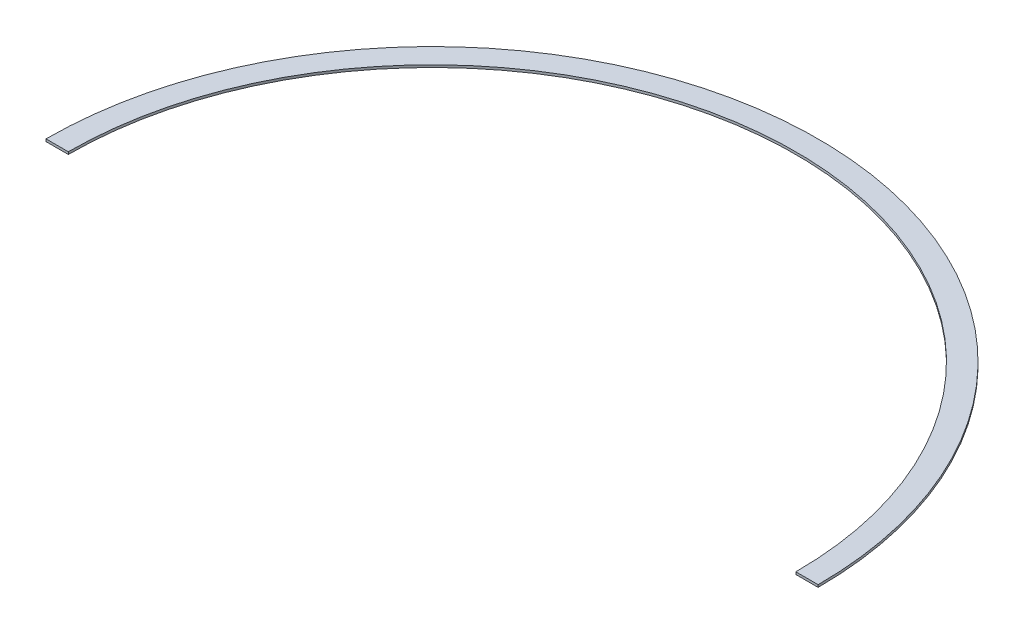
from build123d import *

# Parameters (mm, degrees)
BOSS_EXTRUDE1_DEPTH = 1


with BuildPart() as part:
    # Sketch1 → Boss-Extrude1 (new body)
    with BuildSketch(Plane(origin=(0, 0, 0), x_dir=(1, 0, 0), z_dir=(0, 1, 0))):
        with BuildLine():
            Line((-161.5, 0), (-152.17, 0))
            ThreePointArc((-152.17, 0), (0, 152.17), (152.17, 0))
            Line((152.17, 0), (161.5, 0))
            ThreePointArc((161.5, 0), (0, 161.5), (-161.5, 0))
        make_face()
    extrude(amount=BOSS_EXTRUDE1_DEPTH)


solid = part.part
